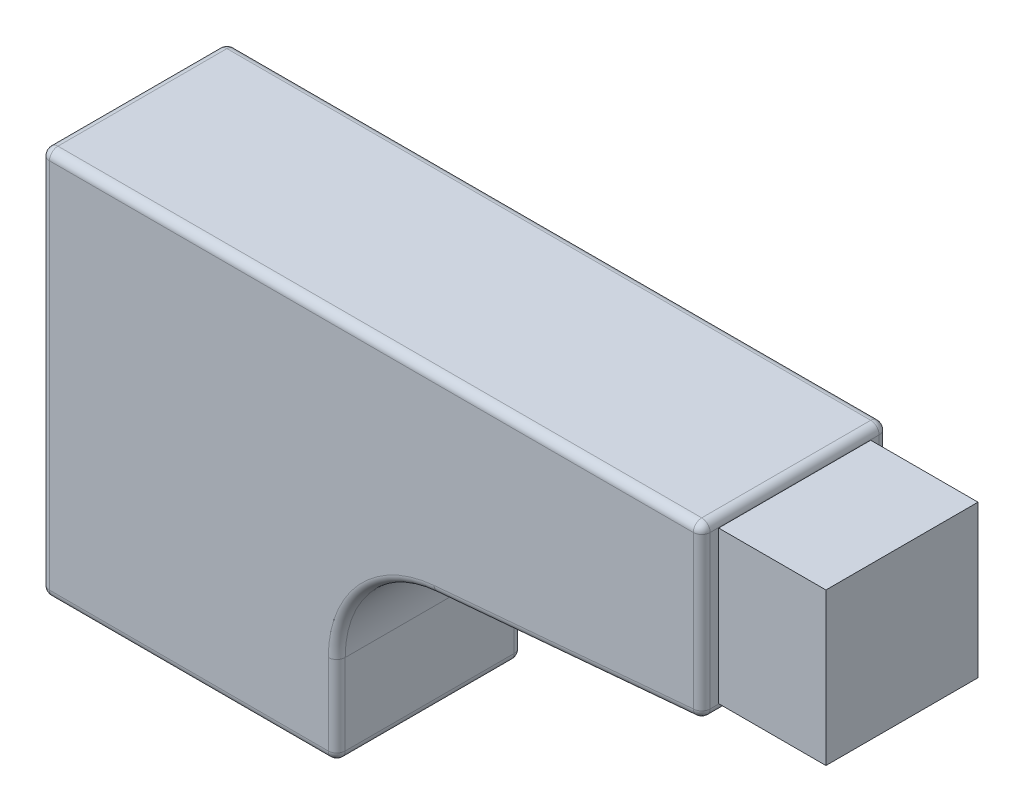
from build123d import *

# Parameters (mm, degrees)
SKETCH1_W           = 39.1
SKETCH1_H           = 23
BOSS_EXTRUDE1_DEPTH = 5.5
CUT_EXTRUDE1_DEPTH  = 26.208183195
FILLET1_R           = 6.35
FILLET2_R           = 0.5
SKETCH3_W           = 9
SKETCH3_H           = 9
BOSS_EXTRUDE2_DEPTH = 6.35


with BuildPart() as part:
    # Sketch1 → Boss-Extrude1 (new, symmetric)
    with BuildSketch(Plane.XY):
        Rectangle(SKETCH1_W, SKETCH1_H)
    extrude(amount=BOSS_EXTRUDE1_DEPTH, both=True)

    # Sketch2 → Cut-Extrude1 (cut, through all)
    with BuildSketch(Plane.XY.offset(5.5)):
        Polygon((19.55, -11.5), (-2.05, -11.5), (-2.05, -0.389755132), (19.55, 1.5), align=None)
    extrude(amount=-CUT_EXTRUDE1_DEPTH, mode=Mode.SUBTRACT)

    # Fillet1
    fillet1_edges = [part.edges().sort_by_distance(p)[0] for p in [
        (-2.05, -0.389755132, 0),
    ]]
    fillet(fillet1_edges, radius=FILLET1_R)

    # Fillet2
    fillet2_edges = [part.edges().sort_by_distance(p)[0] for p in [
        (0, 11.5, 5.5),
        (19.55, 6.5, -5.5),
        (19.55, 6.5, 5.5),
        (19.55, 1.5, 0),
        (-2.05, -11.5, 0),
        (11.648280517, 0.808689123, -5.5),
        (11.648280517, 0.808689123, 5.5),
        (-2.05, -8.854229044, 5.5),
        (-2.05, -8.854229044, -5.5),
        (-0.381711089, -1.918460269, 5.5),
        (-0.381711089, -1.918460269, -5.5),
        (-19.55, 0, 5.5),
        (0, 11.5, -5.5),
        (-10.8, -11.5, -5.5),
        (-19.55, 0, -5.5),
        (-10.8, -11.5, 5.5),
        (-19.55, 11.5, 0),
        (19.55, 11.5, 0),
        (-19.55, -11.5, 0),
    ]]
    fillet(fillet2_edges, radius=FILLET2_R)

    # Sketch3 → Boss-Extrude2 (add)
    with BuildSketch(Plane(origin=(19.55, 0, 0), x_dir=(0, 0, -1), z_dir=(1, 0, 0))):
        with Locations((0, 6.479082794)):
            Rectangle(SKETCH3_W, SKETCH3_H)
    extrude(amount=BOSS_EXTRUDE2_DEPTH)


solid = part.part
